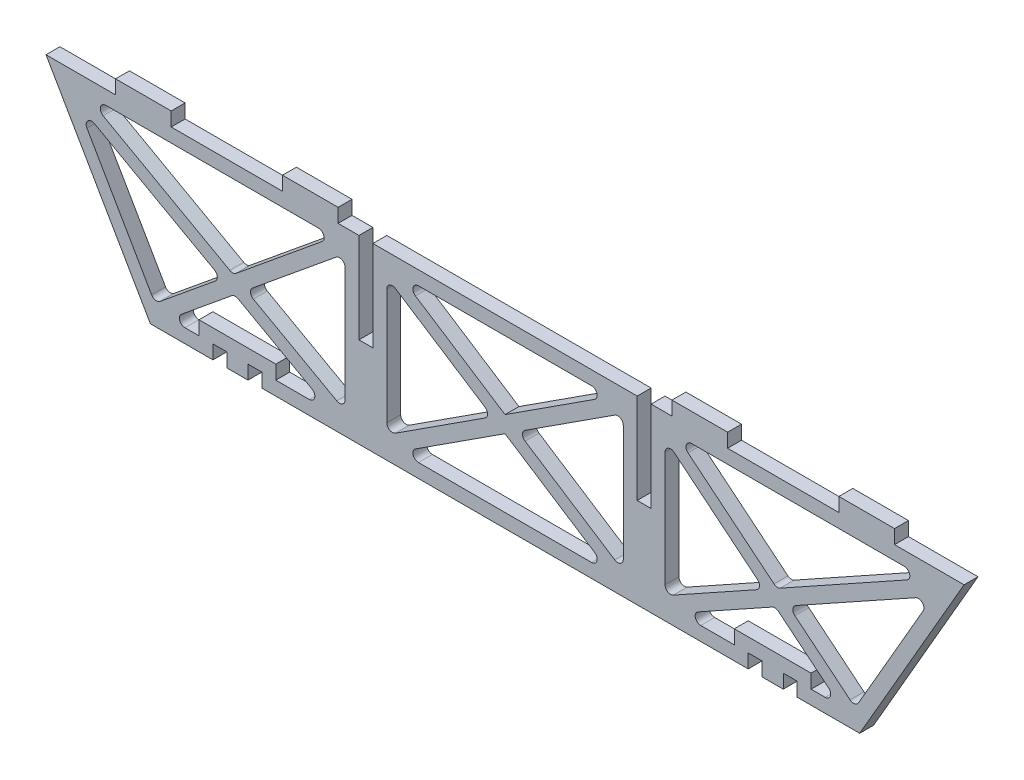
from build123d import *

# Parameters (mm, degrees)
EXTRUDE2_DEPTH = 6.35


with BuildPart() as part:
    # Sketch1 → Extrude2 (new body)
    with BuildSketch(Plane.XY):
        Polygon((47.660264722, 0), (76.2, 0), (76.2, 6.35), (82.55, 6.35), (82.55, 0), (92.202, 0), (92.202, 6.35), (98.552, 6.35), (98.552, 0), (320.548, 0), (320.548, 6.35), (326.898, 6.35), (326.898, 0), (336.55, 0), (336.55, 6.35), (342.9, 6.35), (342.9, 0), (371.439735278, 0), (419.1, 82.55), (387.35, 82.55), (387.35, 88.9), (361.95, 88.9), (361.95, 82.55), (311.15, 82.55), (311.15, 88.9), (285.75, 88.9), (285.75, 82.55), (276.225, 82.55), (276.225, 41.275), (269.875, 41.275), (269.875, 82.55), (149.225, 82.55), (149.225, 41.275), (142.875, 41.275), (142.875, 82.55), (133.35, 82.55), (133.35, 88.9), (107.95, 88.9), (107.95, 82.55), (57.15, 82.55), (57.15, 88.9), (31.75, 88.9), (31.75, 82.55), (0, 82.55), align=None)
        with BuildLine():
            Line((155.575, 67.749415869), (155.575, 14.800584131))
            ThreePointArc((155.575, 14.800584131), (156.901171335, 12.56939163), (159.494858247, 12.668075931))
            Line((159.494858247, 12.668075931), (200.40986459, 39.142491801))
            ThreePointArc((200.40986459, 39.142491801), (201.570006344, 41.275), (200.40986459, 43.407508199))
            Line((200.40986459, 43.407508199), (159.494858247, 69.881924069))
            ThreePointArc((159.494858247, 69.881924069), (156.901171335, 69.98060837), (155.575, 67.749415869))
        make_face(mode=Mode.SUBTRACT)
        with BuildLine():
            Line((170.020448202, 6.35), (249.079551798, 6.35))
            ThreePointArc((249.079551798, 6.35), (251.515549625, 8.170615133), (250.459410045, 11.022508199))
            Line((250.459410045, 11.022508199), (209.55, 37.493302934))
            Line((209.55, 37.493302934), (168.640589955, 11.022508199))
            ThreePointArc((168.640589955, 11.022508199), (167.584450375, 8.170615133), (170.020448202, 6.35))
        make_face(mode=Mode.SUBTRACT)
        with BuildLine():
            Line((52.031551003, 11.033734326), (77.262001053, 31.718906867))
            ThreePointArc((77.262001053, 31.718906867), (78.181456091, 33.910104112), (76.886676101, 35.902662194))
            Line((76.886676101, 35.902662194), (22.118136541, 66.378961445))
            ThreePointArc((22.118136541, 66.378961445), (19.07288135, 65.941246674), (18.683371551, 62.889451217))
            Line((18.683371551, 62.889451217), (48.221461062, 11.727979426))
            ThreePointArc((48.221461062, 11.727979426), (49.965843374, 10.499123351), (52.031551003, 11.033734326))
        make_face(mode=Mode.SUBTRACT)
        with BuildLine():
            Line((61.828236325, 10.8542451), (84.780365617, 29.671537445))
            ThreePointArc((84.780365617, 29.671537445), (86.163798888, 30.2371328), (87.625811497, 29.926802573))
            Line((87.625811497, 29.926802573), (121.442109591, 11.109510228))
            ThreePointArc((121.442109591, 11.109510228), (122.665621474, 8.252017233), (120.207049127, 6.35))
            Line((120.207049127, 6.35), (104.902, 6.35))
            Line((104.902, 6.35), (104.902, 12.7))
            Line((104.902, 12.7), (69.85, 12.7))
            Line((69.85, 12.7), (69.85, 6.35))
            Line((69.85, 6.35), (63.438621741, 6.35))
            ThreePointArc((63.438621741, 6.35), (61.046887793, 8.034892566), (61.828236325, 10.8542451))
        make_face(mode=Mode.SUBTRACT)
        with BuildLine():
            Line((26.081413037, 71.440489772), (83.920586204, 39.255517086))
            ThreePointArc((83.920586204, 39.255517086), (85.382598814, 38.945186859), (86.766032084, 39.510782213))
            Line((86.766032084, 39.510782213), (126.023202606, 71.6957549))
            ThreePointArc((126.023202606, 71.6957549), (126.804551138, 74.515107434), (124.41281719, 76.2))
            Line((124.41281719, 76.2), (27.316473501, 76.2))
            ThreePointArc((27.316473501, 76.2), (24.857901154, 74.297982767), (26.081413037, 71.440489772))
        make_face(mode=Mode.SUBTRACT)
        with BuildLine():
            Line((94.284396649, 37.463412792), (132.374614584, 68.691659953))
            ThreePointArc((132.374614584, 68.691659953), (135.071559028, 69.023278411), (136.525, 66.727414853))
            Line((136.525, 66.727414853), (136.525, 14.303625696))
            ThreePointArc((136.525, 14.303625696), (135.272351238, 12.114030576), (132.749939536, 12.084115469))
            Line((132.749939536, 12.084115469), (94.659721601, 33.279657465))
            ThreePointArc((94.659721601, 33.279657465), (93.364941611, 35.272215547), (94.284396649, 37.463412792))
        make_face(mode=Mode.SUBTRACT)
        with BuildLine():
            Line((168.640589955, 71.527491801), (209.55, 45.056697066))
            Line((209.55, 45.056697066), (250.459410045, 71.527491801))
            ThreePointArc((250.459410045, 71.527491801), (251.515549625, 74.379384867), (249.079551798, 76.2))
            Line((249.079551798, 76.2), (170.020448202, 76.2))
            ThreePointArc((170.020448202, 76.2), (167.584450375, 74.379384867), (168.640589955, 71.527491801))
        make_face(mode=Mode.SUBTRACT)
        with BuildLine():
            Line((282.575, 66.727414853), (282.575, 14.303625696))
            ThreePointArc((282.575, 14.303625696), (283.827648762, 12.114030576), (286.350060464, 12.084115469))
            Line((286.350060464, 12.084115469), (324.440278399, 33.279657465))
            ThreePointArc((324.440278399, 33.279657465), (325.735058389, 35.272215547), (324.815603351, 37.463412792))
            Line((324.815603351, 37.463412792), (286.725385416, 68.691659953))
            ThreePointArc((286.725385416, 68.691659953), (284.028440972, 69.023278411), (282.575, 66.727414853))
        make_face(mode=Mode.SUBTRACT)
        with BuildLine():
            Line((391.783526499, 76.2), (294.68718281, 76.2))
            ThreePointArc((294.68718281, 76.2), (292.295448862, 74.515107434), (293.076797394, 71.6957549))
            Line((293.076797394, 71.6957549), (332.333967916, 39.510782213))
            ThreePointArc((332.333967916, 39.510782213), (333.717401186, 38.945186859), (335.179413796, 39.255517086))
            Line((335.179413796, 39.255517086), (393.018586963, 71.440489772))
            ThreePointArc((393.018586963, 71.440489772), (394.242098846, 74.297982767), (391.783526499, 76.2))
        make_face(mode=Mode.SUBTRACT)
        with BuildLine():
            Line((314.198, 12.7), (314.198, 6.35))
            Line((314.198, 6.35), (298.892950873, 6.35))
            ThreePointArc((298.892950873, 6.35), (296.434378526, 8.252017233), (297.657890409, 11.109510228))
            Line((297.657890409, 11.109510228), (331.474188503, 29.926802573))
            ThreePointArc((331.474188503, 29.926802573), (332.936201112, 30.2371328), (334.319634383, 29.671537445))
            Line((334.319634383, 29.671537445), (357.271763675, 10.8542451))
            ThreePointArc((357.271763675, 10.8542451), (358.053112207, 8.034892566), (355.661378259, 6.35))
            Line((355.661378259, 6.35), (349.25, 6.35))
            Line((349.25, 6.35), (349.25, 12.7))
            Line((349.25, 12.7), (314.198, 12.7))
        make_face(mode=Mode.SUBTRACT)
        with BuildLine():
            Line((400.416628449, 62.889451217), (370.878538938, 11.727979426))
            ThreePointArc((370.878538938, 11.727979426), (369.134156626, 10.499123351), (367.068448997, 11.033734326))
            Line((367.068448997, 11.033734326), (341.837998947, 31.718906867))
            ThreePointArc((341.837998947, 31.718906867), (340.918543909, 33.910104112), (342.213323899, 35.902662194))
            Line((342.213323899, 35.902662194), (396.981863459, 66.378961445))
            ThreePointArc((396.981863459, 66.378961445), (400.02711865, 65.941246674), (400.416628449, 62.889451217))
        make_face(mode=Mode.SUBTRACT)
        with BuildLine():
            Line((259.605141753, 12.668075931), (218.69013541, 39.142491801))
            ThreePointArc((218.69013541, 39.142491801), (217.529993656, 41.275), (218.69013541, 43.407508199))
            Line((218.69013541, 43.407508199), (259.605141753, 69.881924069))
            ThreePointArc((259.605141753, 69.881924069), (262.198828665, 69.98060837), (263.525, 67.749415869))
            Line((263.525, 67.749415869), (263.525, 14.800584131))
            ThreePointArc((263.525, 14.800584131), (262.198828665, 12.56939163), (259.605141753, 12.668075931))
        make_face(mode=Mode.SUBTRACT)
    extrude(amount=EXTRUDE2_DEPTH)


solid = part.part
